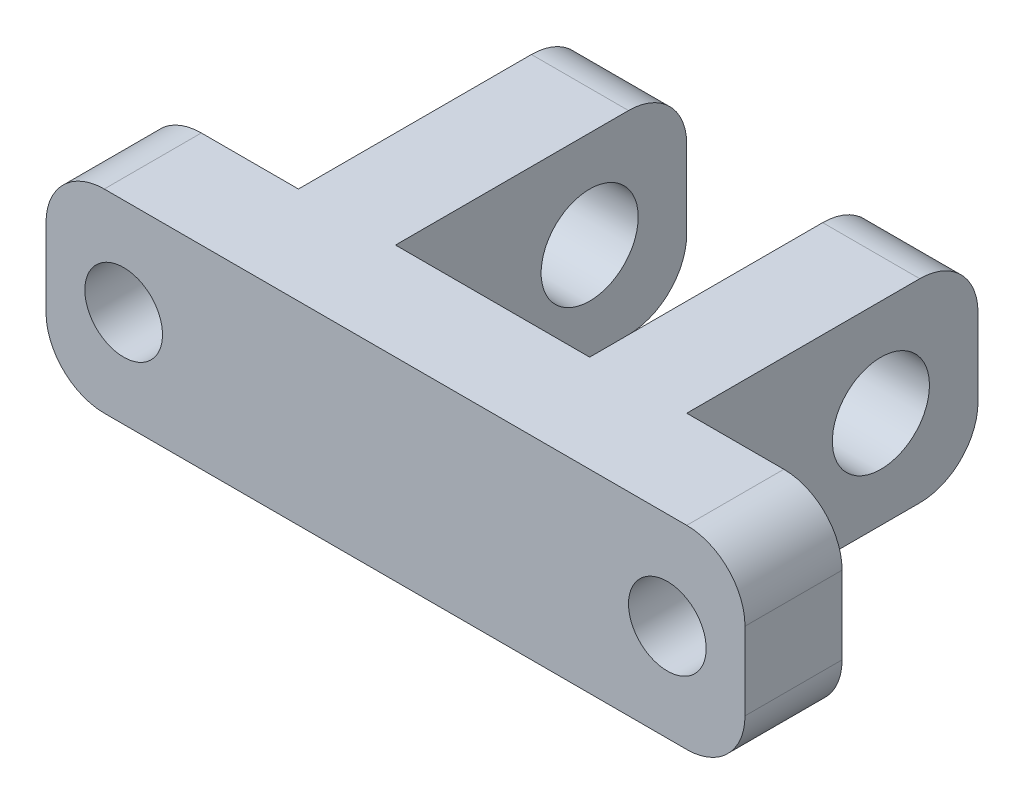
from build123d import *

# Parameters (mm, degrees)
BOSS_EXTRUDE1_DEPTH = 10
SKETCH2_R           = 2.5
CUT_EXTRUDE1_DEPTH  = 36.832945734
FILLET1_R           = 3
SKETCH3_R           = 2
CUT_EXTRUDE2_DEPTH  = 26.475478406


with BuildPart() as part:
    # Sketch1 → Boss-Extrude1 (new body)
    with BuildSketch(Plane(origin=(0, 0, 0), x_dir=(1, 0, 0), z_dir=(0, 1, 0))):
        Polygon((-18, 0), (18, 0), (18, 5), (10, 5), (10, 20), (5, 20), (5, 5), (-5, 5), (-5, 20), (-10, 20), (-10, 5), (-18, 5), align=None)
    extrude(amount=BOSS_EXTRUDE1_DEPTH)

    # Sketch2 → Cut-Extrude1 (cut, through all)
    with BuildSketch(Plane(origin=(10, 0, 0), x_dir=(0, 0, -1), z_dir=(1, 0, 0))):
        with Locations((15, 5)):
            Circle(SKETCH2_R)
    extrude(amount=-CUT_EXTRUDE1_DEPTH, mode=Mode.SUBTRACT)

    # Fillet1
    fillet1_edges = [part.edges().sort_by_distance(p)[0] for p in [
        (18, 0, -2.5),
        (7.5, 10, -20),
        (-18, 0, -2.5),
        (-7.5, 0, -20),
        (7.5, 0, -20),
        (-7.5, 10, -20),
        (-18, 10, -2.5),
        (18, 10, -2.5),
    ]]
    fillet(fillet1_edges, radius=FILLET1_R)

    # Sketch3 → Cut-Extrude2 (cut, through all)
    with BuildSketch(Plane(origin=(0, 0, -5), x_dir=(-1, 0, 0), z_dir=(0, 0, -1))):
        with Locations((14, 5)):
            Circle(SKETCH3_R)
        with Locations((-14, 5)):
            Circle(SKETCH3_R)
    extrude(amount=-CUT_EXTRUDE2_DEPTH, mode=Mode.SUBTRACT)


solid = part.part
